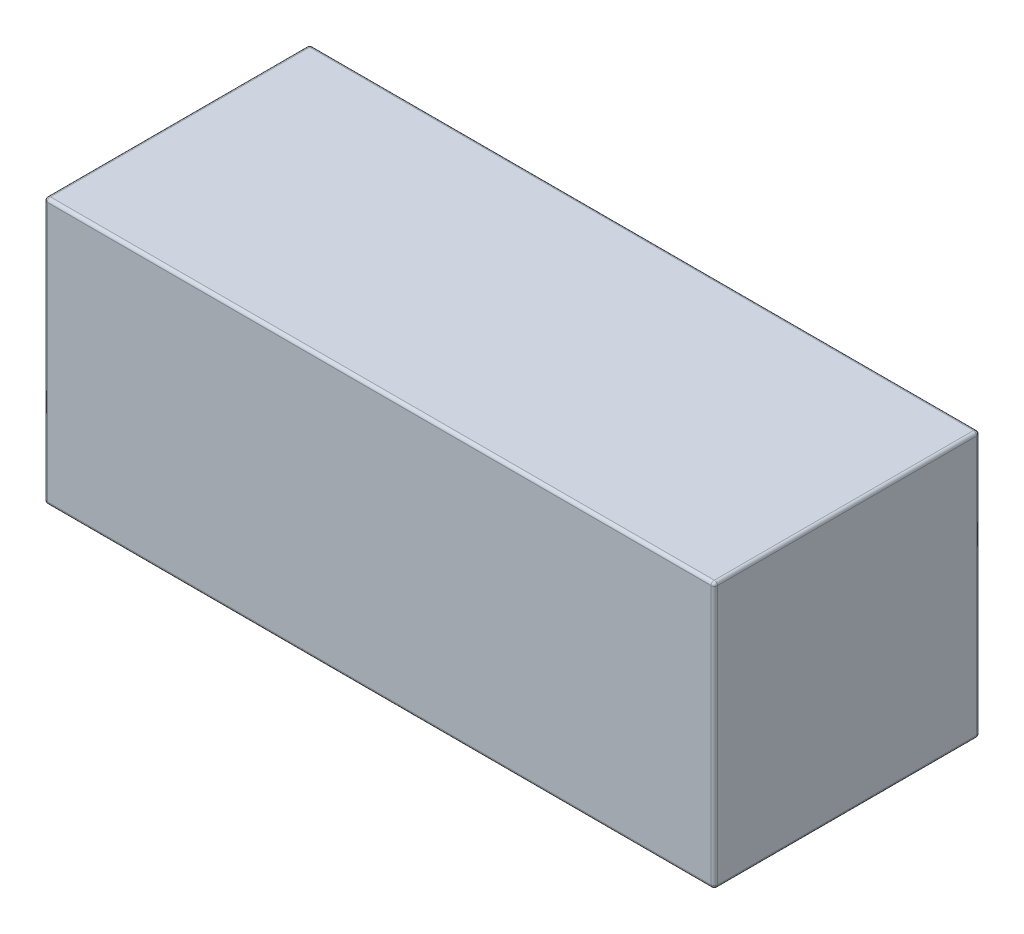
from build123d import *

# Parameters (mm, degrees)
ESQUISSE1_W             = 106
ESQUISSE1_H             = 42
BOSS_EXTRU_1_DEPTH      = 42
ESQUISSE2_W             = 10.5
ESQUISSE2_H             = 10.5
ENL_V_MAT_EXTRU_1_DEPTH = 4.5
CONG_1_R                = 0.5
CHANFREIN1_SIZE         = 0.5


with BuildPart() as part:
    # Esquisse1 → Boss.-Extru.1 (new body)
    with BuildSketch(Plane.XY):
        with Locations((53, -21)):
            Rectangle(ESQUISSE1_W, ESQUISSE1_H)
    extrude(amount=BOSS_EXTRU_1_DEPTH)

    # Esquisse2 → Enlèv. mat.-Extru.1 (cut)
    with BuildSketch(Plane.XZ.offset(42)):
        with Locations((65, 33)):
            Rectangle(ESQUISSE2_W, ESQUISSE2_H)
        with Locations((94, 9)):
            Rectangle(ESQUISSE2_W, ESQUISSE2_H)
        with Locations((94, 33)):
            Rectangle(ESQUISSE2_W, ESQUISSE2_H)
        with Locations((65, 9)):
            Rectangle(ESQUISSE2_W, ESQUISSE2_H)
    enl_v_mat_extru_1 = extrude(amount=-ENL_V_MAT_EXTRU_1_DEPTH, mode=Mode.SUBTRACT)

    # Congé1
    cong_1_edges = [part.edges().sort_by_distance(p)[0] for p in [
        (106, -21, 42),
        (53, 0, 42),
        (0, -21, 42),
        (53, 0, 0),
        (106, -21, 0),
        (53, -42, 0),
        (0, -21, 0),
        (53, -42, 42),
        (0, 0, 21),
        (106, 0, 21),
        (106, -42, 21),
        (0, -42, 21),
    ]]
    fillet(cong_1_edges, radius=CONG_1_R)

    # Symétrie1: Enlèv. mat.-Extru.1 across plane
    add(enl_v_mat_extru_1.mirror(Plane(origin=(53, 0, 0), x_dir=(0, 0, 1), z_dir=(1, 0, 0))), mode=Mode.SUBTRACT)

    # Chanfrein1
    chanfrein1_edges = [part.edges().sort_by_distance(p)[0] for p in [
        (46.25, -42, 33),
        (41, -42, 27.75),
        (35.75, -42, 33),
        (41, -42, 38.25),
        (46.25, -42, 9),
        (41, -42, 3.75),
        (35.75, -42, 9),
        (41, -42, 14.25),
        (17.25, -42, 9),
        (12, -42, 3.75),
        (6.75, -42, 9),
        (12, -42, 14.25),
        (17.25, -42, 33),
        (12, -42, 27.75),
        (6.75, -42, 33),
        (12, -42, 38.25),
        (59.75, -42, 33),
        (65, -42, 27.75),
        (70.25, -42, 33),
        (65, -42, 38.25),
        (59.75, -42, 9),
        (65, -42, 3.75),
        (70.25, -42, 9),
        (65, -42, 14.25),
        (88.75, -42, 9),
        (94, -42, 3.75),
        (99.25, -42, 9),
        (94, -42, 14.25),
        (88.75, -42, 33),
        (94, -42, 27.75),
        (99.25, -42, 33),
        (94, -42, 38.25),
    ]]
    chamfer(chanfrein1_edges, length=CHANFREIN1_SIZE)


solid = part.part
